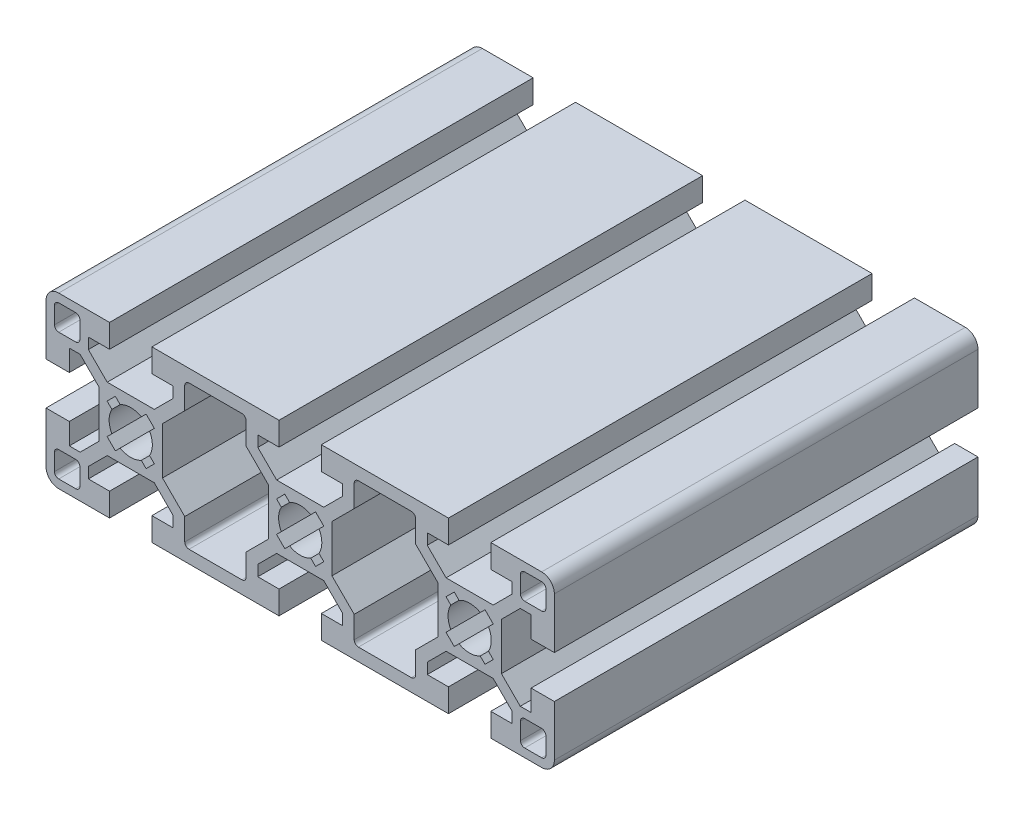
from build123d import *

# Parameters (mm, degrees)
BOSS_EXTRUDE1_DEPTH = 50


with BuildPart() as part:
    # Sketch1 → Boss-Extrude1 (new, symmetric)
    with BuildSketch(Plane.XY):
        with BuildLine():
            Line((-5.555456352, -7.5), (5.555456352, -7.5))
            Line((5.555456352, -7.5), (10, -11.944543648))
            Line((10, -11.944543648), (10, -14.5))
            Line((10, -14.5), (5, -14.5))
            Line((5, -14.5), (5, -20))
            Line((5, -20), (35, -20))
            Line((35, -20), (35, -14.5))
            Line((35, -14.5), (30, -14.5))
            Line((30, -14.5), (30, -11.944543648))
            Line((30, -11.944543648), (34.444543648, -7.5))
            Line((34.444543648, -7.5), (45.555456352, -7.5))
            Line((45.555456352, -7.5), (50, -11.944543648))
            Line((50, -11.944543648), (50, -14.5))
            Line((50, -14.5), (45, -14.5))
            Line((45, -14.5), (45, -20))
            Line((45, -20), (57, -20))
            ThreePointArc((57, -20), (59.121320344, -19.121320344), (60, -17))
            Line((60, -17), (60, -5))
            Line((60, -5), (54.5, -5))
            Line((54.5, -5), (54.5, -10))
            Line((54.5, -10), (51.944543648, -10))
            Line((51.944543648, -10), (47.5, -5.555456352))
            Line((47.5, -5.555456352), (47.5, 5.555456352))
            Line((47.5, 5.555456352), (51.944543648, 10))
            Line((51.944543648, 10), (54.5, 10))
            Line((54.5, 10), (54.5, 5))
            Line((54.5, 5), (60, 5))
            Line((60, 5), (60, 17))
            ThreePointArc((60, 17), (59.121320344, 19.121320344), (57, 20))
            Line((57, 20), (45, 20))
            Line((45, 20), (45, 14.5))
            Line((45, 14.5), (50, 14.5))
            Line((50, 14.5), (50, 11.944543648))
            Line((50, 11.944543648), (45.555456352, 7.5))
            Line((45.555456352, 7.5), (34.444543648, 7.5))
            Line((34.444543648, 7.5), (30, 11.944543648))
            Line((30, 11.944543648), (30, 14.5))
            Line((30, 14.5), (35, 14.5))
            Line((35, 14.5), (35, 20))
            Line((35, 20), (5, 20))
            Line((5, 20), (5, 14.5))
            Line((5, 14.5), (10, 14.5))
            Line((10, 14.5), (10, 11.944543648))
            Line((10, 11.944543648), (5.555456352, 7.5))
            Line((5.555456352, 7.5), (-5.555456352, 7.5))
            Line((-5.555456352, 7.5), (-10, 11.944543648))
            Line((-10, 11.944543648), (-10, 14.5))
            Line((-10, 14.5), (-5, 14.5))
            Line((-5, 14.5), (-5, 20))
            Line((-5, 20), (-35, 20))
            Line((-35, 20), (-35, 14.5))
            Line((-35, 14.5), (-30, 14.5))
            Line((-30, 14.5), (-30, 11.944543648))
            Line((-30, 11.944543648), (-34.444543648, 7.5))
            Line((-34.444543648, 7.5), (-45.555456352, 7.5))
            Line((-45.555456352, 7.5), (-50, 11.944543648))
            Line((-50, 11.944543648), (-50, 14.5))
            Line((-50, 14.5), (-45, 14.5))
            Line((-45, 14.5), (-45, 20))
            Line((-45, 20), (-57, 20))
            ThreePointArc((-57, 20), (-59.121320344, 19.121320344), (-60, 17))
            Line((-60, 17), (-60, 5))
            Line((-60, 5), (-54.5, 5))
            Line((-54.5, 5), (-54.5, 10))
            Line((-54.5, 10), (-51.944543648, 10))
            Line((-51.944543648, 10), (-47.5, 5.555456352))
            Line((-47.5, 5.555456352), (-47.5, -5.555456352))
            Line((-47.5, -5.555456352), (-51.944543648, -10))
            Line((-51.944543648, -10), (-54.5, -10))
            Line((-54.5, -10), (-54.5, -5))
            Line((-54.5, -5), (-60, -5))
            Line((-60, -5), (-60, -17))
            ThreePointArc((-60, -17), (-59.121320344, -19.121320344), (-57, -20))
            Line((-57, -20), (-45, -20))
            Line((-45, -20), (-45, -14.5))
            Line((-45, -14.5), (-50, -14.5))
            Line((-50, -14.5), (-50, -11.944543648))
            Line((-50, -11.944543648), (-45.555456352, -7.5))
            Line((-45.555456352, -7.5), (-34.444543648, -7.5))
            Line((-34.444543648, -7.5), (-30, -11.944543648))
            Line((-30, -11.944543648), (-30, -14.5))
            Line((-30, -14.5), (-35, -14.5))
            Line((-35, -14.5), (-35, -20))
            Line((-35, -20), (-5, -20))
            Line((-5, -20), (-5, -14.5))
            Line((-5, -14.5), (-10, -14.5))
            Line((-10, -14.5), (-10, -11.944543648))
            Line((-10, -11.944543648), (-5.555456352, -7.5))
        make_face()
        with BuildLine():
            Line((-58, 13), (-58, 17))
            ThreePointArc((-58, 17), (-57.707106781, 17.707106781), (-57, 18))
            Line((-57, 18), (-53, 18))
            ThreePointArc((-53, 18), (-52.292893219, 17.707106781), (-52, 17))
            Line((-52, 17), (-52, 13))
            ThreePointArc((-52, 13), (-52.292893219, 12.292893219), (-53, 12))
            Line((-53, 12), (-57, 12))
            ThreePointArc((-57, 12), (-57.707106781, 12.292893219), (-58, 13))
        make_face(mode=Mode.SUBTRACT)
        with BuildLine():
            Line((-35.555022098, -2.500434253), (-34.423651249, -3.631805103))
            Line((-34.423651249, -3.631805103), (-36.368194897, -5.576348751))
            Line((-36.368194897, -5.576348751), (-37.499565747, -4.444977902))
            ThreePointArc((-37.499565747, -4.444977902), (-40, -5.1), (-42.500434253, -4.444977902))
            Line((-42.500434253, -4.444977902), (-43.631805103, -5.576348751))
            Line((-43.631805103, -5.576348751), (-45.576348751, -3.631805103))
            Line((-45.576348751, -3.631805103), (-44.444977902, -2.500434253))
            ThreePointArc((-44.444977902, -2.500434253), (-45.1, 0), (-44.444977902, 2.500434253))
            Line((-44.444977902, 2.500434253), (-45.576348751, 3.631805103))
            Line((-45.576348751, 3.631805103), (-43.631805103, 5.576348751))
            Line((-43.631805103, 5.576348751), (-42.500434253, 4.444977902))
            ThreePointArc((-42.500434253, 4.444977902), (-40, 5.1), (-37.499565747, 4.444977902))
            Line((-37.499565747, 4.444977902), (-36.368194897, 5.576348751))
            Line((-36.368194897, 5.576348751), (-34.423651249, 3.631805103))
            Line((-34.423651249, 3.631805103), (-35.555022098, 2.500434253))
            ThreePointArc((-35.555022098, 2.500434253), (-34.9, 0), (-35.555022098, -2.500434253))
        make_face(mode=Mode.SUBTRACT)
        with BuildLine():
            Line((-58, -17), (-58, -13))
            ThreePointArc((-58, -13), (-57.707106781, -12.292893219), (-57, -12))
            Line((-57, -12), (-53, -12))
            ThreePointArc((-53, -12), (-52.292893219, -12.292893219), (-52, -13))
            Line((-52, -13), (-52, -17))
            ThreePointArc((-52, -17), (-52.292893219, -17.707106781), (-53, -18))
            Line((-53, -18), (-57, -18))
            ThreePointArc((-57, -18), (-57.707106781, -17.707106781), (-58, -17))
        make_face(mode=Mode.SUBTRACT)
        with BuildLine():
            Line((-7.5, 5.555456352), (-7.5, -5.555456352))
            Line((-7.5, -5.555456352), (-12.75, -10.805456352))
            Line((-12.75, -10.805456352), (-12.75, -16))
            ThreePointArc((-12.75, -16), (-13.042893219, -16.707106781), (-13.75, -17))
            Line((-13.75, -17), (-26.25, -17))
            ThreePointArc((-26.25, -17), (-26.957106781, -16.707106781), (-27.25, -16))
            Line((-27.25, -16), (-27.25, -10.805456352))
            Line((-27.25, -10.805456352), (-32.5, -5.555456352))
            Line((-32.5, -5.555456352), (-32.5, 5.555456352))
            Line((-32.5, 5.555456352), (-27.25, 10.805456352))
            Line((-27.25, 10.805456352), (-27.25, 16))
            ThreePointArc((-27.25, 16), (-26.957106781, 16.707106781), (-26.25, 17))
            Line((-26.25, 17), (-13.75, 17))
            ThreePointArc((-13.75, 17), (-13.042893219, 16.707106781), (-12.75, 16))
            Line((-12.75, 16), (-12.75, 10.805456352))
            Line((-12.75, 10.805456352), (-7.5, 5.555456352))
        make_face(mode=Mode.SUBTRACT)
        with BuildLine():
            Line((7.5, -5.555456352), (7.5, 5.555456352))
            Line((7.5, 5.555456352), (12.75, 10.805456352))
            Line((12.75, 10.805456352), (12.75, 16))
            ThreePointArc((12.75, 16), (13.042893219, 16.707106781), (13.75, 17))
            Line((13.75, 17), (26.25, 17))
            ThreePointArc((26.25, 17), (26.957106781, 16.707106781), (27.25, 16))
            Line((27.25, 16), (27.25, 10.805456352))
            Line((27.25, 10.805456352), (32.5, 5.555456352))
            Line((32.5, 5.555456352), (32.5, -5.555456352))
            Line((32.5, -5.555456352), (27.25, -10.805456352))
            Line((27.25, -10.805456352), (27.25, -16))
            ThreePointArc((27.25, -16), (26.957106781, -16.707106781), (26.25, -17))
            Line((26.25, -17), (13.75, -17))
            ThreePointArc((13.75, -17), (13.042893219, -16.707106781), (12.75, -16))
            Line((12.75, -16), (12.75, -10.805456352))
            Line((12.75, -10.805456352), (7.5, -5.555456352))
        make_face(mode=Mode.SUBTRACT)
        with BuildLine():
            Line((58, -13), (58, -17))
            ThreePointArc((58, -17), (57.707106781, -17.707106781), (57, -18))
            Line((57, -18), (53, -18))
            ThreePointArc((53, -18), (52.292893219, -17.707106781), (52, -17))
            Line((52, -17), (52, -13))
            ThreePointArc((52, -13), (52.292893219, -12.292893219), (53, -12))
            Line((53, -12), (57, -12))
            ThreePointArc((57, -12), (57.707106781, -12.292893219), (58, -13))
        make_face(mode=Mode.SUBTRACT)
        with BuildLine():
            Line((35.555022098, 2.500434253), (34.423651249, 3.631805103))
            Line((34.423651249, 3.631805103), (36.368194897, 5.576348751))
            Line((36.368194897, 5.576348751), (37.499565747, 4.444977902))
            ThreePointArc((37.499565747, 4.444977902), (40, 5.1), (42.500434253, 4.444977902))
            Line((42.500434253, 4.444977902), (43.631805103, 5.576348751))
            Line((43.631805103, 5.576348751), (45.576348751, 3.631805103))
            Line((45.576348751, 3.631805103), (44.444977902, 2.500434253))
            ThreePointArc((44.444977902, 2.500434253), (45.1, 0), (44.444977902, -2.500434253))
            Line((44.444977902, -2.500434253), (45.576348751, -3.631805103))
            Line((45.576348751, -3.631805103), (43.631805103, -5.576348751))
            Line((43.631805103, -5.576348751), (42.500434253, -4.444977902))
            ThreePointArc((42.500434253, -4.444977902), (40, -5.1), (37.499565747, -4.444977902))
            Line((37.499565747, -4.444977902), (36.368194897, -5.576348751))
            Line((36.368194897, -5.576348751), (34.423651249, -3.631805103))
            Line((34.423651249, -3.631805103), (35.555022098, -2.500434253))
            ThreePointArc((35.555022098, -2.500434253), (34.9, 0), (35.555022098, 2.500434253))
        make_face(mode=Mode.SUBTRACT)
        with BuildLine():
            Line((58, 17), (58, 13))
            ThreePointArc((58, 13), (57.707106781, 12.292893219), (57, 12))
            Line((57, 12), (53, 12))
            ThreePointArc((53, 12), (52.292893219, 12.292893219), (52, 13))
            Line((52, 13), (52, 17))
            ThreePointArc((52, 17), (52.292893219, 17.707106781), (53, 18))
            Line((53, 18), (57, 18))
            ThreePointArc((57, 18), (57.707106781, 17.707106781), (58, 17))
        make_face(mode=Mode.SUBTRACT)
        with BuildLine():
            Line((-2.500434253, -4.444977902), (-3.631805103, -5.576348751))
            Line((-3.631805103, -5.576348751), (-5.576348751, -3.631805103))
            Line((-5.576348751, -3.631805103), (-4.444977902, -2.500434253))
            ThreePointArc((-4.444977902, -2.500434253), (-5.1, 0), (-4.444977902, 2.500434253))
            Line((-4.444977902, 2.500434253), (-5.576348751, 3.631805103))
            Line((-5.576348751, 3.631805103), (-3.631805103, 5.576348751))
            Line((-3.631805103, 5.576348751), (-2.500434253, 4.444977902))
            ThreePointArc((-2.500434253, 4.444977902), (0, 5.1), (2.500434253, 4.444977902))
            Line((2.500434253, 4.444977902), (3.631805103, 5.576348751))
            Line((3.631805103, 5.576348751), (5.576348751, 3.631805103))
            Line((5.576348751, 3.631805103), (4.444977902, 2.500434253))
            ThreePointArc((4.444977902, 2.500434253), (5.1, 0), (4.444977902, -2.500434253))
            Line((4.444977902, -2.500434253), (5.576348751, -3.631805103))
            Line((5.576348751, -3.631805103), (3.631805103, -5.576348751))
            Line((3.631805103, -5.576348751), (2.500434253, -4.444977902))
            ThreePointArc((2.500434253, -4.444977902), (0, -5.1), (-2.500434253, -4.444977902))
        make_face(mode=Mode.SUBTRACT)
    extrude(amount=BOSS_EXTRUDE1_DEPTH, both=True)


solid = part.part
